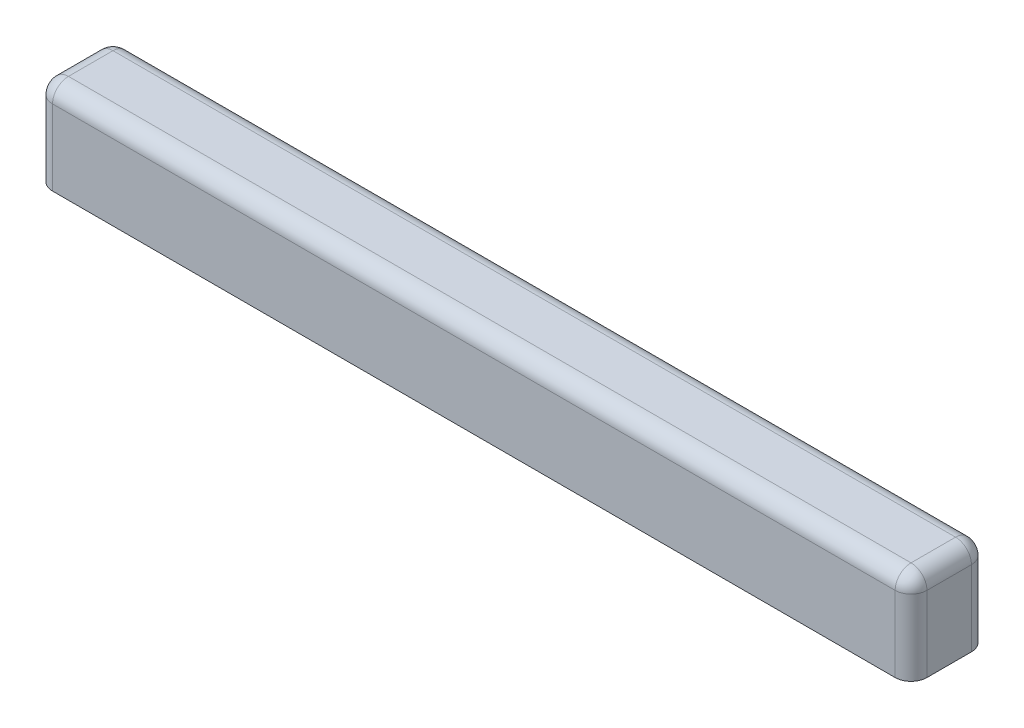
from build123d import *

# Parameters (mm, degrees)
SKETCH1_W           = 110
SKETCH1_H           = 9.6
BOSS_EXTRUDE1_DEPTH = 11.5
FILLET1_R           = 2


with BuildPart() as part:
    # Sketch1 → Boss-Extrude1 (new body)
    with BuildSketch(Plane(origin=(0, 0, 0), x_dir=(1, 0, 0), z_dir=(0, 1, 0))):
        Rectangle(SKETCH1_W, SKETCH1_H)
    extrude(amount=BOSS_EXTRUDE1_DEPTH)

    # Fillet1
    fillet1_edges = [part.edges().sort_by_distance(p)[0] for p in [
        (-55, 11.5, 0),
        (0, 11.5, 4.8),
        (55, 11.5, 0),
        (55, 5.75, 4.8),
        (-55, 5.75, 4.8),
        (-55, 5.75, -4.8),
        (55, 5.75, -4.8),
        (0, 11.5, -4.8),
    ]]
    fillet(fillet1_edges, radius=FILLET1_R)


solid = part.part
